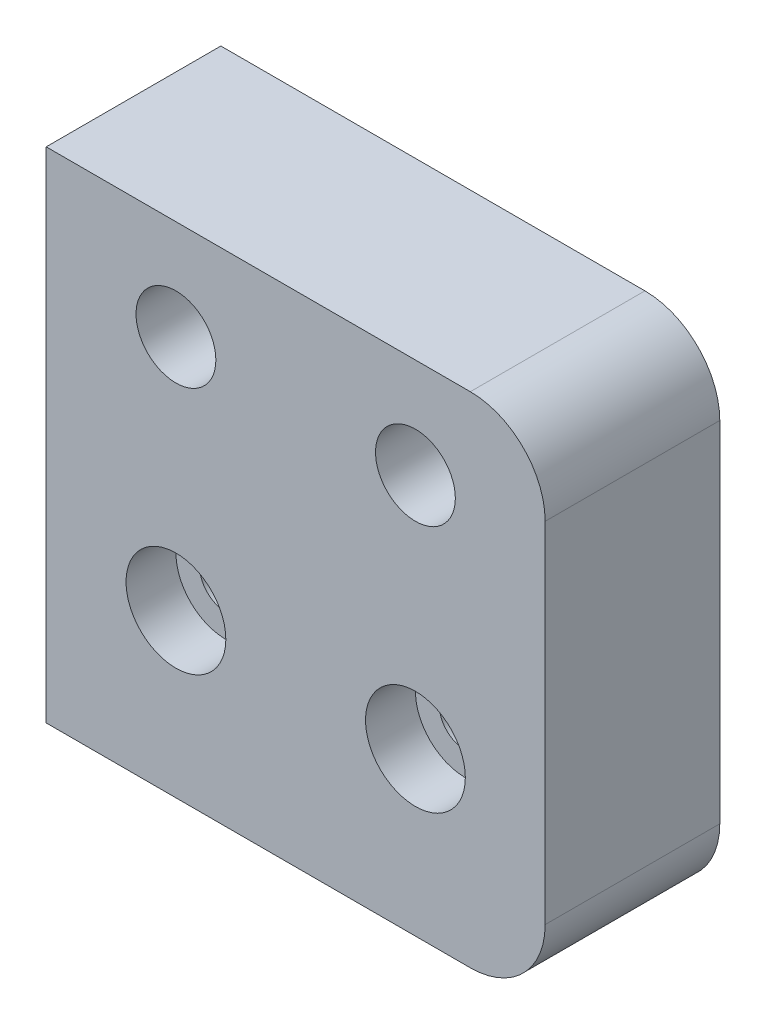
from build123d import *

# Parameters (mm, degrees)
SKETCH1_R           = 1.6
SKETCH1_R_2         = 1.05
BOSS_EXTRUDE1_DEPTH = 7
SKETCH2_R           = 2
CUT_EXTRUDE1_DEPTH  = 2


with BuildPart() as part:
    # Sketch1 → Boss-Extrude1 (new body)
    with BuildSketch(Plane.XY):
        with BuildLine():
            Line((0, 0), (17, 0))
            ThreePointArc((17, 0), (19.121320344, 0.878679656), (20, 3))
            Line((20, 3), (20, 17))
            ThreePointArc((20, 17), (19.121320344, 19.121320344), (17, 20))
            Line((17, 20), (0, 20))
            Line((0, 20), (0, 0))
        make_face()
        with Locations((5.2, 16)):
            Circle(SKETCH1_R, mode=Mode.SUBTRACT)
        with Locations((14.8, 16)):
            Circle(SKETCH1_R, mode=Mode.SUBTRACT)
        with Locations((5.2, 6.5)):
            Circle(SKETCH1_R_2, mode=Mode.SUBTRACT)
        with Locations((14.8, 6.5)):
            Circle(SKETCH1_R_2, mode=Mode.SUBTRACT)
    extrude(amount=BOSS_EXTRUDE1_DEPTH)

    # Sketch2 → Cut-Extrude1 (cut)
    with BuildSketch(Plane.XY.offset(7)):
        with Locations((5.2, 6.5)):
            Circle(SKETCH2_R)
        with Locations((14.8, 6.5)):
            Circle(SKETCH2_R)
    extrude(amount=-CUT_EXTRUDE1_DEPTH, mode=Mode.SUBTRACT)


solid = part.part
